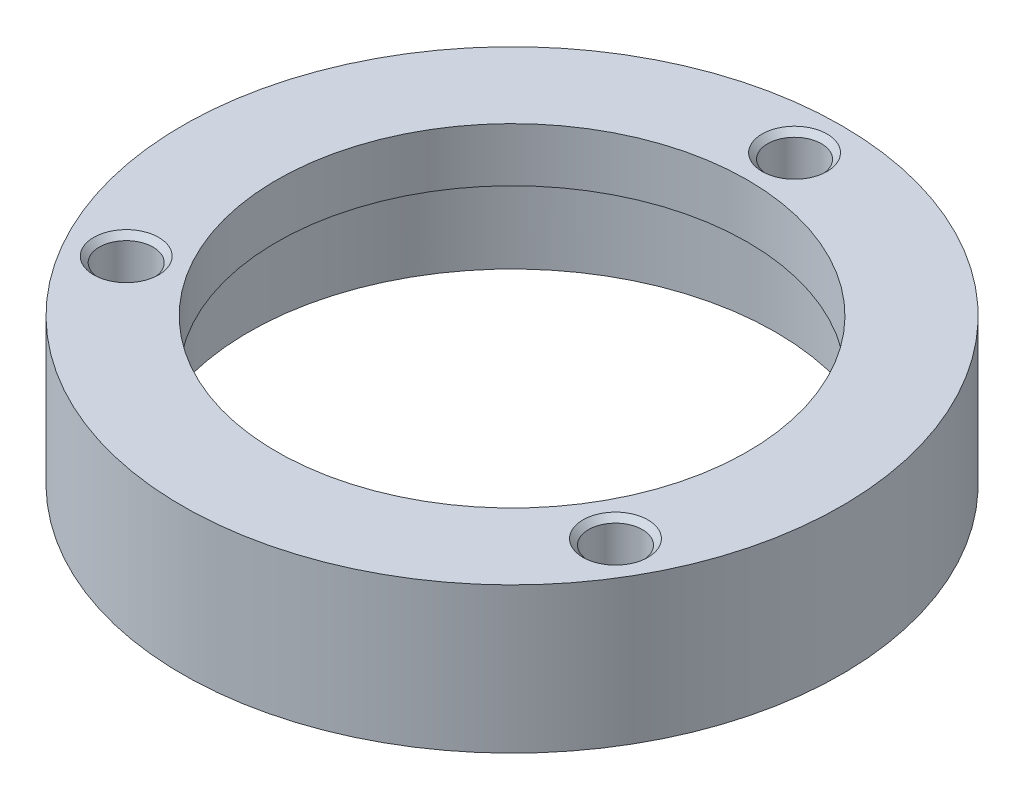
from build123d import *

# Parameters (mm, degrees)
SKETCH1_R           = 29.4
SKETCH1_R_2         = 21
BOSS_EXTRUDE1_DEPTH = 13
SKETCH2_R           = 2.4
CUT_EXTRUDE1_DEPTH  = 4
CHAMFER1_SIZE       = 0.5
SKETCH4_R           = 23.5
CUT_EXTRUDE2_DEPTH  = 8.2


with BuildPart() as part:
    # Sketch1 → Boss-Extrude1 (new body)
    with BuildSketch(Plane(origin=(0, 0, 0), x_dir=(1, 0, 0), z_dir=(0, 1, 0))):
        with Locations(Location((0, 0, 0), (0, 0, 90))):
            Circle(SKETCH1_R)
        with Locations(Location((0, 0, 0), (0, 0, 90))):
            Circle(SKETCH1_R_2, mode=Mode.SUBTRACT)
    extrude(amount=BOSS_EXTRUDE1_DEPTH)

    # Sketch2 → Cut-Extrude1 (cut)
    with BuildSketch(Plane(origin=(0, 13, 0), x_dir=(1, 0, 0), z_dir=(0, 1, 0))):
        with Locations(Location((0, 25.2, 0), (0, 0, 270))):
            Circle(SKETCH2_R)
        with Locations(Location((21.823840175, -12.6, 0), (0, 0, 270))):
            Circle(SKETCH2_R)
        with Locations(Location((-21.823840175, -12.6, 0), (0, 0, 270))):
            Circle(SKETCH2_R)
    extrude(amount=-CUT_EXTRUDE1_DEPTH, mode=Mode.SUBTRACT)

    # Chamfer1
    chamfer1_edges = [part.edges().sort_by_distance(p)[0] for p in [
        (0, 13, -27.6),
        (21.823840175, 13, 10.2),
        (-21.823840175, 13, 10.2),
    ]]
    chamfer(chamfer1_edges, length=CHAMFER1_SIZE)

    # Sketch4 → Cut-Extrude2 (cut)
    with BuildSketch(Plane.XZ):
        with Locations(Location((0, 0, 0), (0, 0, 270))):
            Circle(SKETCH4_R)
    extrude(amount=-CUT_EXTRUDE2_DEPTH, mode=Mode.SUBTRACT)


solid = part.part
